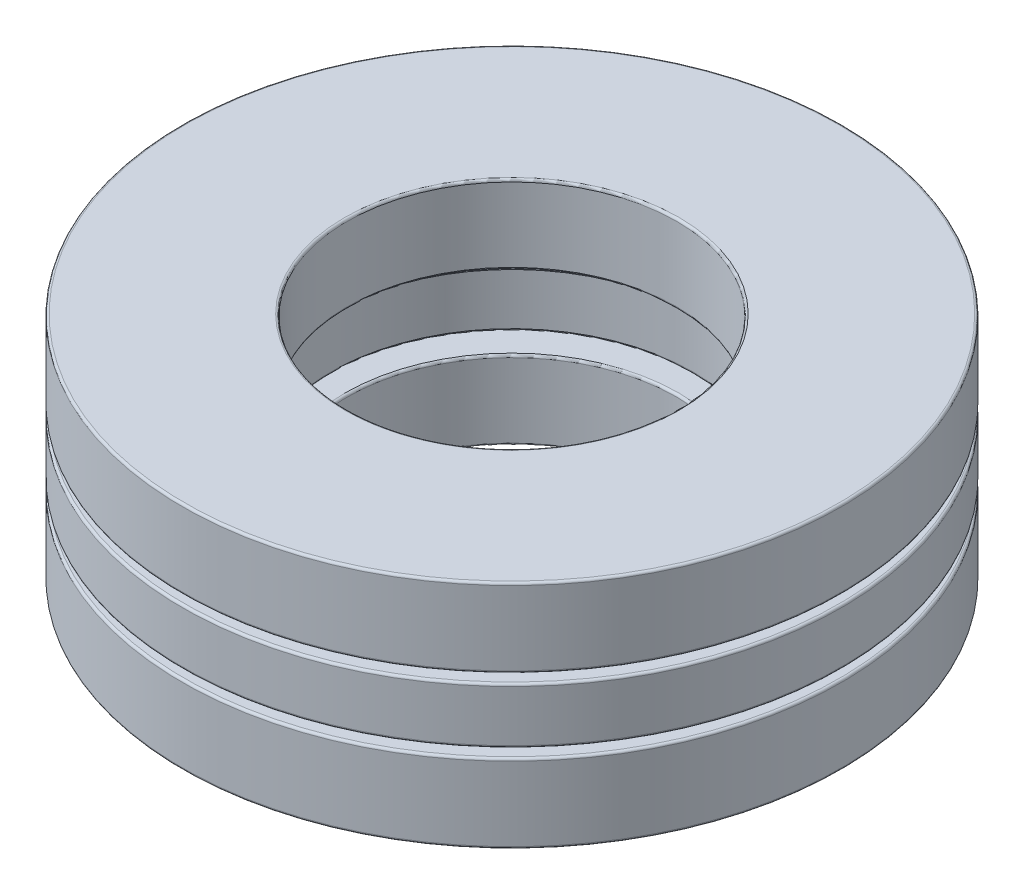
from build123d import *

# Parameters (mm, degrees)
CIRPATTERN2_COUNT = 16
CIRPATTERN3_COUNT = 16


with BuildPart() as part:
    # Sketch2 → Revolve2 (revolve)
    with BuildSketch(Plane.XY, mode=Mode.PRIVATE) as revolve2_sk:
        with BuildLine():
            Line((-11, -1.55375), (-11, 1.55375))
            ThreePointArc((-11, 1.55375), (-11.041005051, 1.652744949), (-11.14, 1.69375))
            Line((-11.14, 1.69375), (-19.86, 1.69375))
            ThreePointArc((-19.86, 1.69375), (-19.958994949, 1.652744949), (-20, 1.55375))
            Line((-20, 1.55375), (-20, -1.55375))
            ThreePointArc((-20, -1.55375), (-19.958994949, -1.652744949), (-19.86, -1.69375))
            Line((-19.86, -1.69375), (-11.14, -1.69375))
            ThreePointArc((-11.14, -1.69375), (-11.041005051, -1.652744949), (-11, -1.55375))
        make_face()
    revolve(revolve2_sk.sketch.rotate(Axis((0, -7, 0), (0, 1, 0)), 270), axis=Axis((0, -7, 0), (0, 1, 0)))

    # Sketch3 → Cut-Revolve1 (revolve, cut)
    with BuildSketch(Plane.XY):
        with BuildLine():
            Line((-15.5, 2.7725), (-15.5, -2.7725))
            ThreePointArc((-15.5, -2.7725), (-18.2725, 0), (-15.5, 2.7725))
        make_face()
    cut_revolve1 = revolve(axis=Axis((-15.5, 2.7725, 0), (0, -1, 0)), mode=Mode.SUBTRACT)

    # CirPattern2: Cut-Revolve1 ×16 about axis
    cirpattern2_axis = Axis((0, 0, 0), (0, 1, 0))
    for i in range(1, CIRPATTERN2_COUNT):
        add(cut_revolve1.rotate(cirpattern2_axis, i * 360 / CIRPATTERN2_COUNT), mode=Mode.SUBTRACT)


with BuildPart() as body_2:
    # Sketch4 → Revolve3 (revolve)
    with BuildSketch(Plane.XY, mode=Mode.PRIVATE) as revolve3_sk:
        with BuildLine():
            Line((-19.86, 2.233125), (-17.143139977, 2.233125))
            ThreePointArc((-17.143139977, 2.233125), (-15.5, 2.7725), (-13.856860023, 2.233125))
            Line((-13.856860023, 2.233125), (-10.14, 2.233125))
            ThreePointArc((-10.14, 2.233125), (-10.041005051, 2.274130051), (-10, 2.373125))
            Line((-10, 2.373125), (-10, 6.86))
            ThreePointArc((-10, 6.86), (-10.041005051, 6.958994949), (-10.14, 7))
            Line((-10.14, 7), (-19.86, 7))
            ThreePointArc((-19.86, 7), (-19.958994949, 6.958994949), (-20, 6.86))
            Line((-20, 6.86), (-20, 2.373125))
            ThreePointArc((-20, 2.373125), (-19.958994949, 2.274130051), (-19.86, 2.233125))
        make_face()
    revolve(revolve3_sk.sketch.rotate(Axis((0, -7, 0), (0, 1, 0)), 270), axis=Axis((0, -7, 0), (0, 1, 0)))


with BuildPart() as body_3:
    # Mirror1: mirrored copy
    add(body_2.part.mirror(Plane.ZX))


with BuildPart() as body_4:
    # Sketch5 → Revolve4 (revolve)
    with BuildSketch(Plane.XY):
        with BuildLine():
            Line((-15.5, 2.71), (-15.5, -2.71))
            ThreePointArc((-15.5, -2.71), (-18.21, 0), (-15.5, 2.71))
        make_face()
    revolve(axis=Axis((-15.5, 2.71, 0), (0, -1, 0)))


with BuildPart() as cirpattern3_1:
    # CirPattern3: pattern copy
    add(body_4.part.rotate(Axis((0, 0, 0), (0, 1, 0)), 1 * 360 / CIRPATTERN3_COUNT))


with BuildPart() as cirpattern3_2:
    # CirPattern3: pattern copy
    add(body_4.part.rotate(Axis((0, 0, 0), (0, 1, 0)), 2 * 360 / CIRPATTERN3_COUNT))


with BuildPart() as cirpattern3_3:
    # CirPattern3: pattern copy
    add(body_4.part.rotate(Axis((0, 0, 0), (0, 1, 0)), 3 * 360 / CIRPATTERN3_COUNT))


with BuildPart() as cirpattern3_4:
    # CirPattern3: pattern copy
    add(body_4.part.rotate(Axis((0, 0, 0), (0, 1, 0)), 4 * 360 / CIRPATTERN3_COUNT))


with BuildPart() as cirpattern3_5:
    # CirPattern3: pattern copy
    add(body_4.part.rotate(Axis((0, 0, 0), (0, 1, 0)), 5 * 360 / CIRPATTERN3_COUNT))


with BuildPart() as cirpattern3_6:
    # CirPattern3: pattern copy
    add(body_4.part.rotate(Axis((0, 0, 0), (0, 1, 0)), 6 * 360 / CIRPATTERN3_COUNT))


with BuildPart() as cirpattern3_7:
    # CirPattern3: pattern copy
    add(body_4.part.rotate(Axis((0, 0, 0), (0, 1, 0)), 7 * 360 / CIRPATTERN3_COUNT))


with BuildPart() as cirpattern3_8:
    # CirPattern3: pattern copy
    add(body_4.part.rotate(Axis((0, 0, 0), (0, 1, 0)), 8 * 360 / CIRPATTERN3_COUNT))


with BuildPart() as cirpattern3_9:
    # CirPattern3: pattern copy
    add(body_4.part.rotate(Axis((0, 0, 0), (0, 1, 0)), 9 * 360 / CIRPATTERN3_COUNT))


with BuildPart() as cirpattern3_10:
    # CirPattern3: pattern copy
    add(body_4.part.rotate(Axis((0, 0, 0), (0, 1, 0)), 10 * 360 / CIRPATTERN3_COUNT))


with BuildPart() as cirpattern3_11:
    # CirPattern3: pattern copy
    add(body_4.part.rotate(Axis((0, 0, 0), (0, 1, 0)), 11 * 360 / CIRPATTERN3_COUNT))


with BuildPart() as cirpattern3_12:
    # CirPattern3: pattern copy
    add(body_4.part.rotate(Axis((0, 0, 0), (0, 1, 0)), 12 * 360 / CIRPATTERN3_COUNT))


with BuildPart() as cirpattern3_13:
    # CirPattern3: pattern copy
    add(body_4.part.rotate(Axis((0, 0, 0), (0, 1, 0)), 13 * 360 / CIRPATTERN3_COUNT))


with BuildPart() as cirpattern3_14:
    # CirPattern3: pattern copy
    add(body_4.part.rotate(Axis((0, 0, 0), (0, 1, 0)), 14 * 360 / CIRPATTERN3_COUNT))


with BuildPart() as cirpattern3_15:
    # CirPattern3: pattern copy
    add(body_4.part.rotate(Axis((0, 0, 0), (0, 1, 0)), 15 * 360 / CIRPATTERN3_COUNT))


solid = Compound([part.part, body_2.part, body_3.part, body_4.part, cirpattern3_1.part, cirpattern3_2.part, cirpattern3_3.part, cirpattern3_4.part, cirpattern3_5.part, cirpattern3_6.part, cirpattern3_7.part, cirpattern3_8.part, cirpattern3_9.part, cirpattern3_10.part, cirpattern3_11.part, cirpattern3_12.part, cirpattern3_13.part, cirpattern3_14.part, cirpattern3_15.part])
